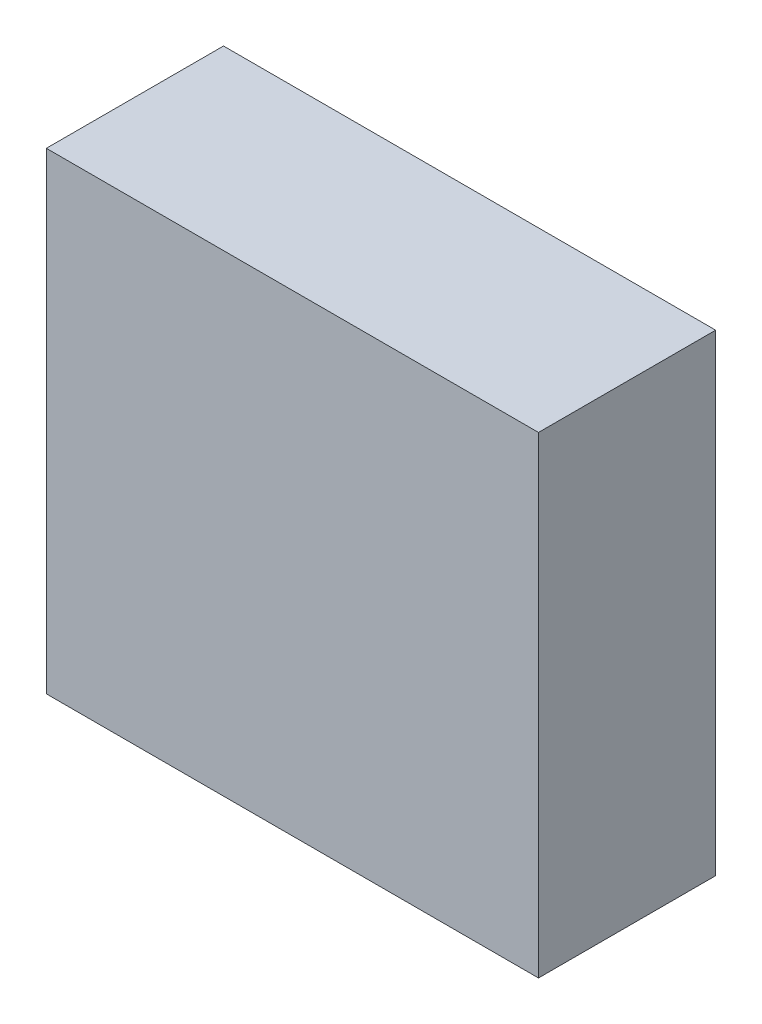
from build123d import *

# Parameters (mm, degrees)
SKETCH1_W           = 25
SKETCH1_H           = 24
BOSS_EXTRUDE1_DEPTH = 9


with BuildPart() as part:
    # Sketch1 → Boss-Extrude1 (new body)
    with BuildSketch(Plane.XY):
        Rectangle(SKETCH1_W, SKETCH1_H)
    extrude(amount=BOSS_EXTRUDE1_DEPTH)


solid = part.part
